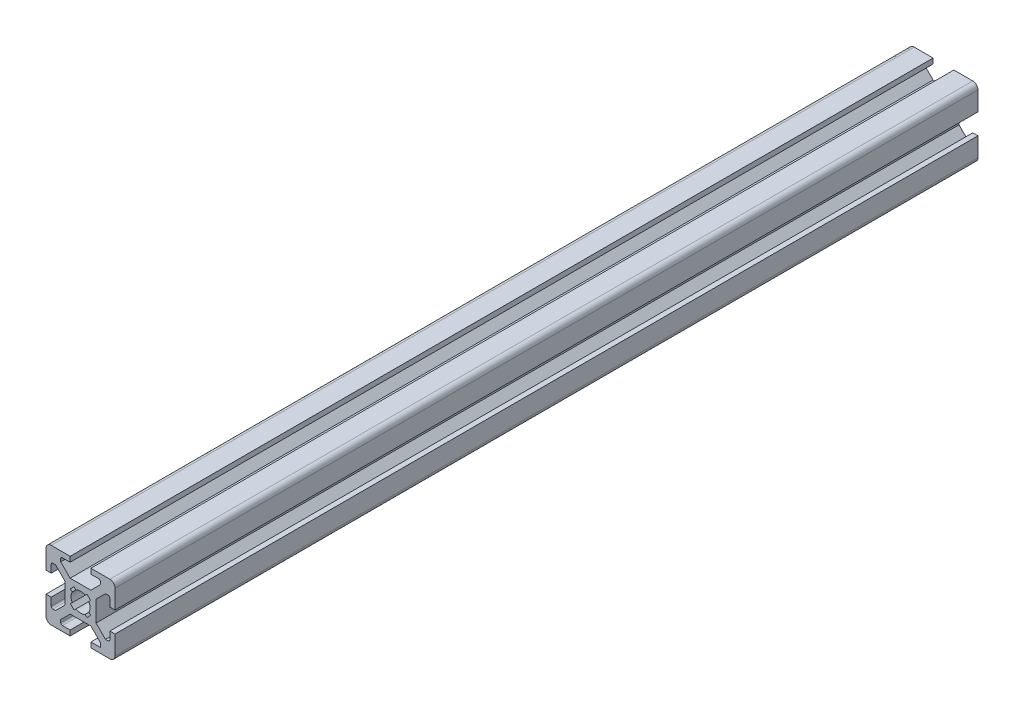
from build123d import *

# Parameters (mm, degrees)
SALIENTE_EXTRUIR1_DEPTH = 250
REDONDEO1_R             = 1.5
REDONDEO2_R             = 0.5
CORTAR_EXTRUIR1_DEPTH   = 251.399680511


with BuildPart() as part:
    # Croquis1 → Saliente-Extruir1 (new body)
    with BuildSketch(Plane.XY):
        Polygon((3, -4.5), (5.7413765, -7.2413765), (5.7413765, -8.5), (3, -8.5), (3, -10), (10, -10), (10, -3), (8.5, -3), (8.5, -5.7413765), (7.2413765, -5.7413765), (4.5, -3), (4.5, 3), (7.2413765, 5.7413765), (8.5, 5.7413765), (8.5, 3), (10, 3), (10, 10), (3, 10), (3, 8.5), (5.7413765, 8.5), (5.7413765, 7.2413765), (3, 4.5), (-3, 4.5), (-5.7413765, 7.2413765), (-5.7413765, 8.5), (-3, 8.5), (-3, 10), (-10, 10), (-10, 3), (-8.5, 3), (-8.5, 5.7413765), (-7.2413765, 5.7413765), (-4.5, 3), (-4.5, -3), (-7.2413765, -5.7413765), (-8.5, -5.7413765), (-8.5, -3), (-10, -3), (-10, -10), (-3, -10), (-3, -8.5), (-5.7413765, -8.5), (-5.7413765, -7.2413765), (-3, -4.5), align=None)
    extrude(amount=SALIENTE_EXTRUIR1_DEPTH)

    # Redondeo1
    redondeo1_edges = [part.edges().sort_by_distance(p)[0] for p in [
        (10, -10, 125),
        (-10, -10, 125),
        (-10, 10, 125),
        (10, 10, 125),
    ]]
    fillet(redondeo1_edges, radius=REDONDEO1_R)

    # Redondeo2
    redondeo2_edges = [part.edges().sort_by_distance(p)[0] for p in [
        (-5.7413765, -8.5, 125),
        (-8.5, -5.7413765, 125),
        (-8.5, 5.7413765, 125),
        (-5.7413765, 8.5, 125),
        (5.7413765, 8.5, 125),
        (8.5, 5.7413765, 125),
        (8.5, -5.7413765, 125),
    ]]
    fillet(redondeo2_edges, radius=REDONDEO2_R)

    # Croquis2 → Cortar-Extruir1 (cut, through all)
    with BuildSketch(Plane(origin=(0, 0, 0), x_dir=(-1, 0, 0), z_dir=(0, 0, -1))):
        with BuildLine():
            Line((-1.340498607, 2.401158779), (-1.870828693, 2.931488865))
            Line((-1.870828693, 2.931488865), (-2.931488865, 1.870828693))
            Line((-2.931488865, 1.870828693), (-2.401158779, 1.340498607))
            ThreePointArc((-2.401158779, 1.340498607), (-2.75, 0), (-2.401158779, -1.340498607))
            Line((-2.401158779, -1.340498607), (-2.931488865, -1.870828693))
            Line((-2.931488865, -1.870828693), (-1.870828693, -2.931488865))
            Line((-1.870828693, -2.931488865), (-1.340498607, -2.401158779))
            ThreePointArc((-1.340498607, -2.401158779), (0, -2.75), (1.340498607, -2.401158779))
            Line((1.340498607, -2.401158779), (1.870828693, -2.931488865))
            Line((1.870828693, -2.931488865), (2.931488865, -1.870828693))
            Line((2.931488865, -1.870828693), (2.401158779, -1.340498607))
            ThreePointArc((2.401158779, -1.340498607), (2.75, 0), (2.401158779, 1.340498607))
            Line((2.401158779, 1.340498607), (2.931488865, 1.870828693))
            Line((2.931488865, 1.870828693), (1.870828693, 2.931488865))
            Line((1.870828693, 2.931488865), (1.340498607, 2.401158779))
            ThreePointArc((1.340498607, 2.401158779), (0, 2.75), (-1.340498607, 2.401158779))
        make_face()
    extrude(amount=-CORTAR_EXTRUIR1_DEPTH, mode=Mode.SUBTRACT)


solid = part.part
